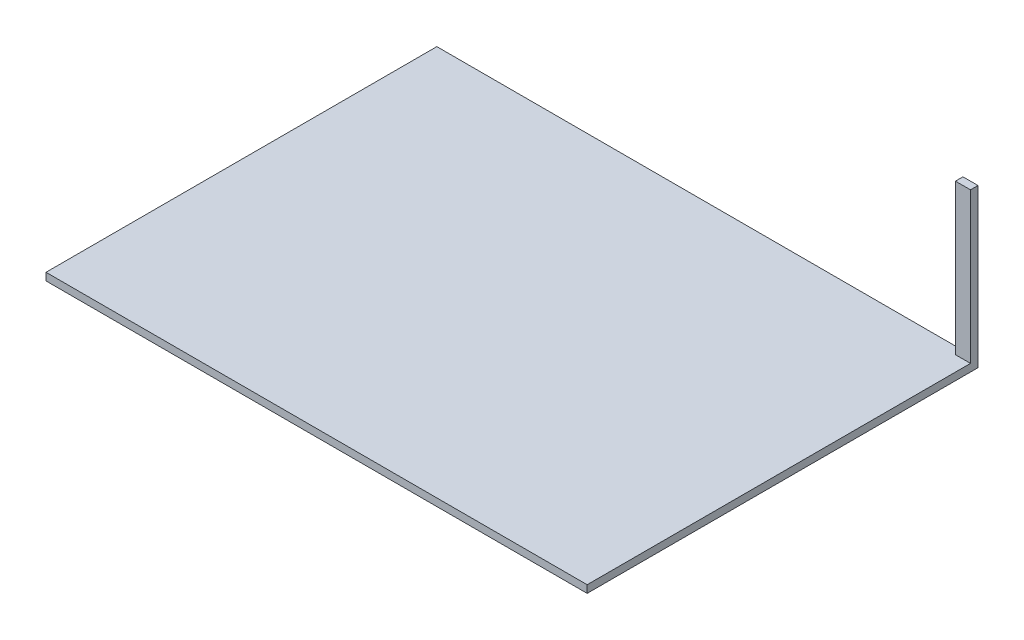
from build123d import *

# Parameters (mm, degrees)
ESQUISSE1_W        = 360
ESQUISSE1_H        = 260
BOSS_EXTRU_1_DEPTH = 5
ESQUISSE3_W        = 10
ESQUISSE3_H        = 5
BOSS_EXTRU_3_DEPTH = 100


with BuildPart() as part:
    # Esquisse1 → Boss.-Extru.1 (new body)
    with BuildSketch(Plane(origin=(0, 0, 0), x_dir=(1, 0, 0), z_dir=(0, 1, 0))):
        Rectangle(ESQUISSE1_W, ESQUISSE1_H)
    extrude(amount=BOSS_EXTRU_1_DEPTH)

    # Esquisse3 → Boss.-Extru.3 (add)
    with BuildSketch(Plane(origin=(0, 5, 0), x_dir=(1, 0, 0), z_dir=(0, 1, 0))):
        with Locations((175, 127.5)):
            Rectangle(ESQUISSE3_W, ESQUISSE3_H)
    extrude(amount=BOSS_EXTRU_3_DEPTH)


solid = part.part
